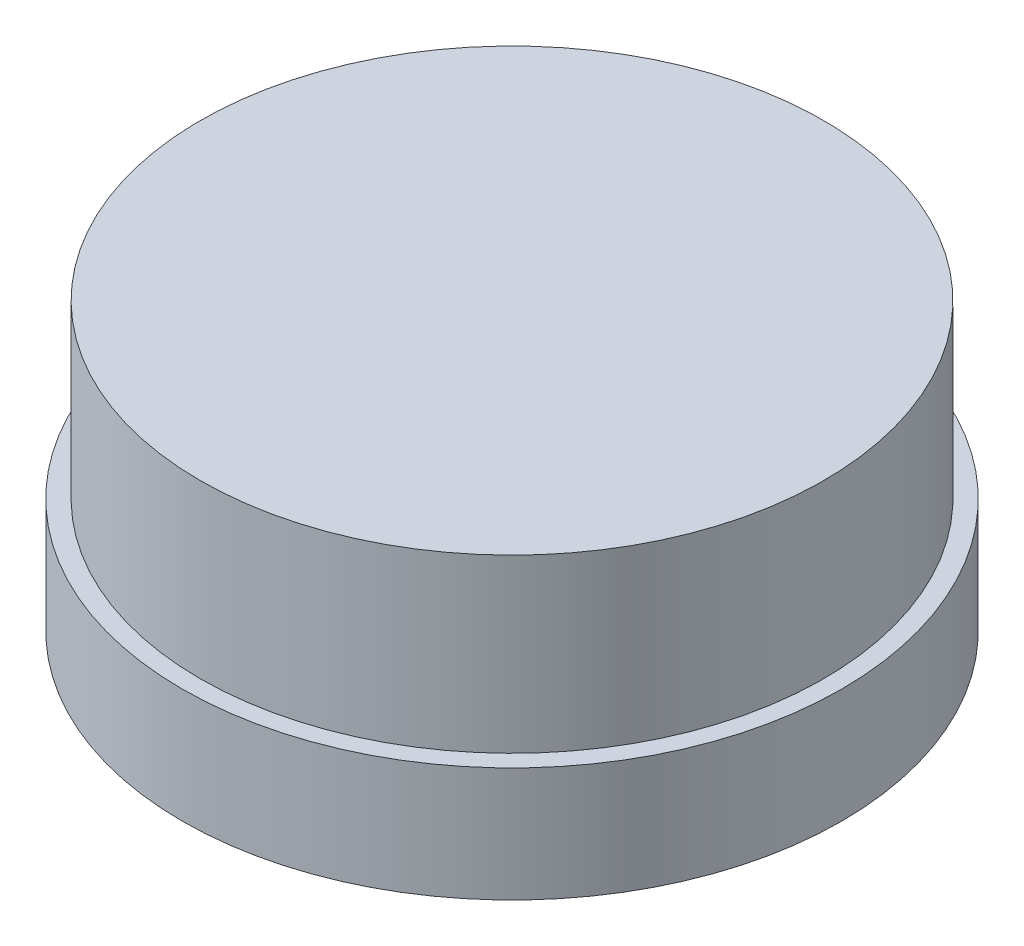
from build123d import *

# Parameters (mm, degrees)
SKETCH_1_R      = 16.35
EXTRUDE_1_DEPTH = 9
SKETCH_2_R      = 17.29
EXTRUDE_2_DEPTH = 6


with BuildPart() as part:
    # 草图1 → 凸台-拉伸1 (new body)
    with BuildSketch(Plane(origin=(0, 0, 0), x_dir=(1, 0, 0), z_dir=(0, 1, 0))):
        with Locations(Location((0, 0, 0), (0, 0, 270))):
            Circle(SKETCH_1_R)
    extrude(amount=EXTRUDE_1_DEPTH)

    # 草图2 → 凸台-拉伸2 (add)
    with BuildSketch(Plane.XZ):
        with Locations(Location((0, 0, 0), (0, 0, 270))):
            Circle(SKETCH_2_R)
    extrude(amount=EXTRUDE_2_DEPTH)


solid = part.part
